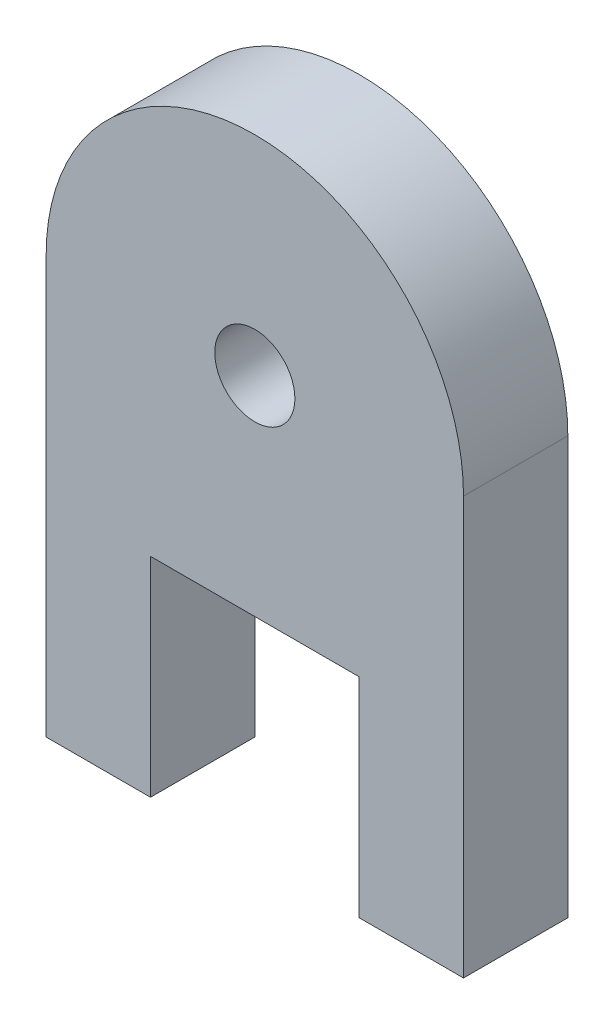
from build123d import *

# Parameters (mm, degrees)
SKETCH1_R           = 0.6096
BOSS_EXTRUDE1_DEPTH = 1.5875
SKETCH2_W           = 3.175
SKETCH2_H           = 3.175
CUT_EXTRUDE1_DEPTH  = 8.274838916


with BuildPart() as part:
    # Sketch1 → Boss-Extrude1 (new body)
    with BuildSketch(Plane.XY):
        with BuildLine():
            Line((-3.175, 0), (-3.175, -6.35))
            Line((-3.175, -6.35), (3.175, -6.35))
            Line((3.175, -6.35), (3.175, 0))
            ThreePointArc((3.175, 0), (0, 3.175), (-3.175, 0))
        make_face()
        Circle(SKETCH1_R, mode=Mode.SUBTRACT)
    extrude(amount=BOSS_EXTRUDE1_DEPTH)

    # Sketch2 → Cut-Extrude1 (cut, through all)
    with BuildSketch(Plane(origin=(0, 0, 0), x_dir=(-1, 0, 0), z_dir=(0, 0, -1))):
        with Locations((0, -4.7625)):
            Rectangle(SKETCH2_W, SKETCH2_H)
    extrude(amount=-CUT_EXTRUDE1_DEPTH, mode=Mode.SUBTRACT)


solid = part.part
